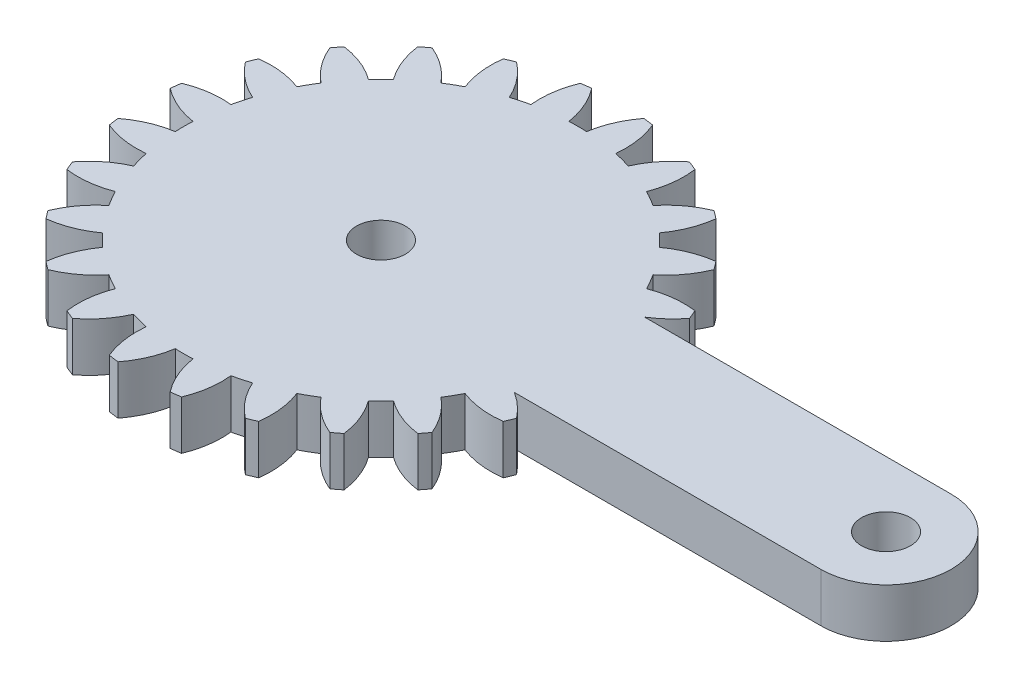
from build123d import *

# Parameters (mm, degrees)
SKETCH1_R           = 1.5
BOSS_EXTRUDE1_DEPTH = 3
SCALE1_SCALE        = 0.888888889


with BuildPart() as part:
    # Sketch1 → Boss-Extrude1 (new body)
    with BuildSketch(Plane(origin=(0, 0, 0), x_dir=(1, 0, 0), z_dir=(0, 1, 0))):
        with BuildLine():
            Line((20.893657446, 4), (2.081641936, 4))
            ThreePointArc((2.081641936, 4), (2.861028333, 4.588201733), (3.521749436, 5.30713988))
            ThreePointArc((3.521749436, 5.30713988), (3.405395609, 5.596745198), (3.282888305, 5.883801663))
            ThreePointArc((3.282888305, 5.883801663), (1.93527598, 5.894040025), (0.627094961, 5.57027124))
            ThreePointArc((0.627094961, 5.57027124), (0.366286148, 6.046375), (0.084372603, 6.510293938))
            ThreePointArc((0.084372603, 6.510293938), (1.018855105, 7.48132754), (1.683794586, 8.65351323))
            ThreePointArc((1.683794586, 8.65351323), (1.496450048, 8.903135899), (1.303821399, 9.148703928))
            ThreePointArc((1.303821399, 9.148703928), (-0.000522033, 8.809805691), (-1.180330337, 8.158486898))
            ThreePointArc((-1.180330337, 8.158486898), (-1.555477026, 8.550865528), (-1.947855656, 8.926012217))
            ThreePointArc((-1.947855656, 8.926012217), (-1.296536862, 10.105820521), (-0.957638625, 11.410163953))
            ThreePointArc((-0.957638625, 11.410163953), (-1.203206655, 11.602792602), (-1.452829324, 11.79013714))
            ThreePointArc((-1.452829324, 11.79013714), (-2.625015014, 11.125197659), (-3.596048616, 10.190715157))
            ThreePointArc((-3.596048616, 10.190715157), (-4.059967554, 10.472628702), (-4.536071314, 10.733437515))
            ThreePointArc((-4.536071314, 10.733437515), (-4.212302529, 12.041618533), (-4.222540891, 13.389230859))
            ThreePointArc((-4.222540891, 13.389230859), (-4.509597355, 13.511738163), (-4.799202674, 13.62809199))
            ThreePointArc((-4.799202674, 13.62809199), (-5.759348103, 12.682425791), (-6.455432668, 11.528463019))
            ThreePointArc((-6.455432668, 11.528463019), (-6.976508546, 11.680699536), (-7.503891752, 11.809396783))
            ThreePointArc((-7.503891752, 11.809396783), (-7.529737283, 13.156800143), (-7.888414517, 14.455843809))
            ThreePointArc((-7.888414517, 14.455843809), (-8.197396993, 14.499881098), (-8.507248835, 14.537314892))
            ThreePointArc((-8.507248835, 14.537314892), (-9.18992168, 13.375367565), (-9.563620196, 12.080565177))
            ThreePointArc((-9.563620196, 12.080565177), (-10.106342554, 12.09275), (-10.649064912, 12.080565177))
            ThreePointArc((-10.649064912, 12.080565177), (-11.022763428, 13.375367565), (-11.705436272, 14.537314892))
            ThreePointArc((-11.705436272, 14.537314892), (-12.015288115, 14.499881098), (-12.324270591, 14.455843809))
            ThreePointArc((-12.324270591, 14.455843809), (-12.682947825, 13.156800143), (-12.708793355, 11.809396783))
            ThreePointArc((-12.708793355, 11.809396783), (-13.236176561, 11.680699536), (-13.757252439, 11.528463019))
            ThreePointArc((-13.757252439, 11.528463019), (-14.453337005, 12.682425791), (-15.413482434, 13.62809199))
            ThreePointArc((-15.413482434, 13.62809199), (-15.703087752, 13.511738163), (-15.990144217, 13.389230859))
            ThreePointArc((-15.990144217, 13.389230859), (-16.000382579, 12.041618533), (-15.676613793, 10.733437515))
            ThreePointArc((-15.676613793, 10.733437515), (-16.152717554, 10.472628702), (-16.616636492, 10.190715157))
            ThreePointArc((-16.616636492, 10.190715157), (-17.587670094, 11.125197659), (-18.759855783, 11.79013714))
            ThreePointArc((-18.759855783, 11.79013714), (-19.009478453, 11.602792602), (-19.255046482, 11.410163953))
            ThreePointArc((-19.255046482, 11.410163953), (-18.916148245, 10.105820521), (-18.264829452, 8.926012217))
            ThreePointArc((-18.264829452, 8.926012217), (-18.657208082, 8.550865528), (-19.032354771, 8.158486898))
            ThreePointArc((-19.032354771, 8.158486898), (-20.212163074, 8.809805691), (-21.516506507, 9.148703928))
            ThreePointArc((-21.516506507, 9.148703928), (-21.709135156, 8.903135899), (-21.896479694, 8.65351323))
            ThreePointArc((-21.896479694, 8.65351323), (-21.231540213, 7.48132754), (-20.297057711, 6.510293938))
            ThreePointArc((-20.297057711, 6.510293938), (-20.578971255, 6.046375), (-20.839780068, 5.57027124))
            ThreePointArc((-20.839780068, 5.57027124), (-22.147961087, 5.894040025), (-23.495573413, 5.883801663))
            ThreePointArc((-23.495573413, 5.883801663), (-23.618080717, 5.596745198), (-23.734434544, 5.30713988))
            ThreePointArc((-23.734434544, 5.30713988), (-22.788768345, 4.346994451), (-21.634805572, 3.650909885))
            ThreePointArc((-21.634805572, 3.650909885), (-21.78704209, 3.129834008), (-21.915739337, 2.602450802))
            ThreePointArc((-21.915739337, 2.602450802), (-23.263142697, 2.576605271), (-24.562186363, 2.217928037))
            ThreePointArc((-24.562186363, 2.217928037), (-24.606223651, 1.908945561), (-24.643657446, 1.599093719))
            ThreePointArc((-24.643657446, 1.599093719), (-23.481710119, 0.916420874), (-22.186907731, 0.542722358))
            ThreePointArc((-22.186907731, 0.542722358), (-22.199092554, 0), (-22.186907731, -0.542722358))
            ThreePointArc((-22.186907731, -0.542722358), (-23.481710119, -0.916420874), (-24.643657446, -1.599093719))
            ThreePointArc((-24.643657446, -1.599093719), (-24.606223651, -1.908945561), (-24.562186363, -2.217928037))
            ThreePointArc((-24.562186363, -2.217928037), (-23.263142697, -2.576605271), (-21.915739337, -2.602450802))
            ThreePointArc((-21.915739337, -2.602450802), (-21.78704209, -3.129834008), (-21.634805572, -3.650909885))
            ThreePointArc((-21.634805572, -3.650909885), (-22.788768345, -4.346994451), (-23.734434544, -5.30713988))
            ThreePointArc((-23.734434544, -5.30713988), (-23.618080717, -5.596745198), (-23.495573413, -5.883801663))
            ThreePointArc((-23.495573413, -5.883801663), (-22.147961087, -5.894040025), (-20.839780068, -5.57027124))
            ThreePointArc((-20.839780068, -5.57027124), (-20.578971255, -6.046375), (-20.297057711, -6.510293938))
            ThreePointArc((-20.297057711, -6.510293938), (-21.231540213, -7.48132754), (-21.896479694, -8.65351323))
            ThreePointArc((-21.896479694, -8.65351323), (-21.709135156, -8.903135899), (-21.516506507, -9.148703928))
            ThreePointArc((-21.516506507, -9.148703928), (-20.212163074, -8.809805691), (-19.032354771, -8.158486898))
            ThreePointArc((-19.032354771, -8.158486898), (-18.657208082, -8.550865528), (-18.264829452, -8.926012217))
            ThreePointArc((-18.264829452, -8.926012217), (-18.916148245, -10.105820521), (-19.255046482, -11.410163953))
            ThreePointArc((-19.255046482, -11.410163953), (-19.009478453, -11.602792602), (-18.759855783, -11.79013714))
            ThreePointArc((-18.759855783, -11.79013714), (-17.587670094, -11.125197659), (-16.616636492, -10.190715157))
            ThreePointArc((-16.616636492, -10.190715157), (-16.152717554, -10.472628702), (-15.676613793, -10.733437515))
            ThreePointArc((-15.676613793, -10.733437515), (-16.000382579, -12.041618533), (-15.990144217, -13.389230859))
            ThreePointArc((-15.990144217, -13.389230859), (-15.703087752, -13.511738163), (-15.413482434, -13.62809199))
            ThreePointArc((-15.413482434, -13.62809199), (-14.453337005, -12.682425791), (-13.757252439, -11.528463019))
            ThreePointArc((-13.757252439, -11.528463019), (-13.236176561, -11.680699536), (-12.708793355, -11.809396783))
            ThreePointArc((-12.708793355, -11.809396783), (-12.682947825, -13.156800143), (-12.324270591, -14.455843809))
            ThreePointArc((-12.324270591, -14.455843809), (-12.015288115, -14.499881098), (-11.705436272, -14.537314892))
            ThreePointArc((-11.705436272, -14.537314892), (-11.022763428, -13.375367565), (-10.649064912, -12.080565177))
            ThreePointArc((-10.649064912, -12.080565177), (-10.106342554, -12.09275), (-9.563620196, -12.080565177))
            ThreePointArc((-9.563620196, -12.080565177), (-9.18992168, -13.375367565), (-8.507248835, -14.537314892))
            ThreePointArc((-8.507248835, -14.537314892), (-8.197396993, -14.499881098), (-7.888414517, -14.455843809))
            ThreePointArc((-7.888414517, -14.455843809), (-7.529737283, -13.156800143), (-7.503891752, -11.809396783))
            ThreePointArc((-7.503891752, -11.809396783), (-6.976508546, -11.680699536), (-6.455432668, -11.528463019))
            ThreePointArc((-6.455432668, -11.528463019), (-5.759348103, -12.682425791), (-4.799202674, -13.62809199))
            ThreePointArc((-4.799202674, -13.62809199), (-4.509597355, -13.511738163), (-4.222540891, -13.389230859))
            ThreePointArc((-4.222540891, -13.389230859), (-4.212302529, -12.041618533), (-4.536071314, -10.733437515))
            ThreePointArc((-4.536071314, -10.733437515), (-4.059967554, -10.472628702), (-3.596048616, -10.190715157))
            ThreePointArc((-3.596048616, -10.190715157), (-2.625015014, -11.125197659), (-1.452829324, -11.79013714))
            ThreePointArc((-1.452829324, -11.79013714), (-1.203206655, -11.602792602), (-0.957638625, -11.410163953))
            ThreePointArc((-0.957638625, -11.410163953), (-1.296536862, -10.105820521), (-1.947855656, -8.926012217))
            ThreePointArc((-1.947855656, -8.926012217), (-1.555477026, -8.550865528), (-1.180330337, -8.158486898))
            ThreePointArc((-1.180330337, -8.158486898), (-0.000522033, -8.809805691), (1.303821399, -9.148703928))
            ThreePointArc((1.303821399, -9.148703928), (1.496450048, -8.903135899), (1.683794586, -8.65351323))
            ThreePointArc((1.683794586, -8.65351323), (1.018855105, -7.48132754), (0.084372603, -6.510293938))
            ThreePointArc((0.084372603, -6.510293938), (0.366286148, -6.046375), (0.627094961, -5.57027124))
            ThreePointArc((0.627094961, -5.57027124), (1.93527598, -5.894040025), (3.282888305, -5.883801663))
            ThreePointArc((3.282888305, -5.883801663), (3.405395609, -5.596745198), (3.521749436, -5.30713988))
            ThreePointArc((3.521749436, -5.30713988), (2.861028333, -4.588201733), (2.081641936, -4))
            Line((2.081641936, -4), (20.893657446, -4))
            ThreePointArc((20.893657446, -4), (24.893657446, 0), (20.893657446, 4))
        make_face()
        with Locations(Location((-10.106342554, 0, 0), (0, 0, 270))):
            Circle(SKETCH1_R, mode=Mode.SUBTRACT)
        with Locations(Location((20.893657446, 0, 0), (0, 0, 270))):
            Circle(SKETCH1_R, mode=Mode.SUBTRACT)
    extrude(amount=BOSS_EXTRUDE1_DEPTH)


with BuildPart() as part_1:
    # Scale1: scaled about (-4.801213178, 1.5, 0)
    add(part.part.scale(SCALE1_SCALE).moved(Location((-0.533468131, 0.166666667, 0))))


solid = part_1.part
